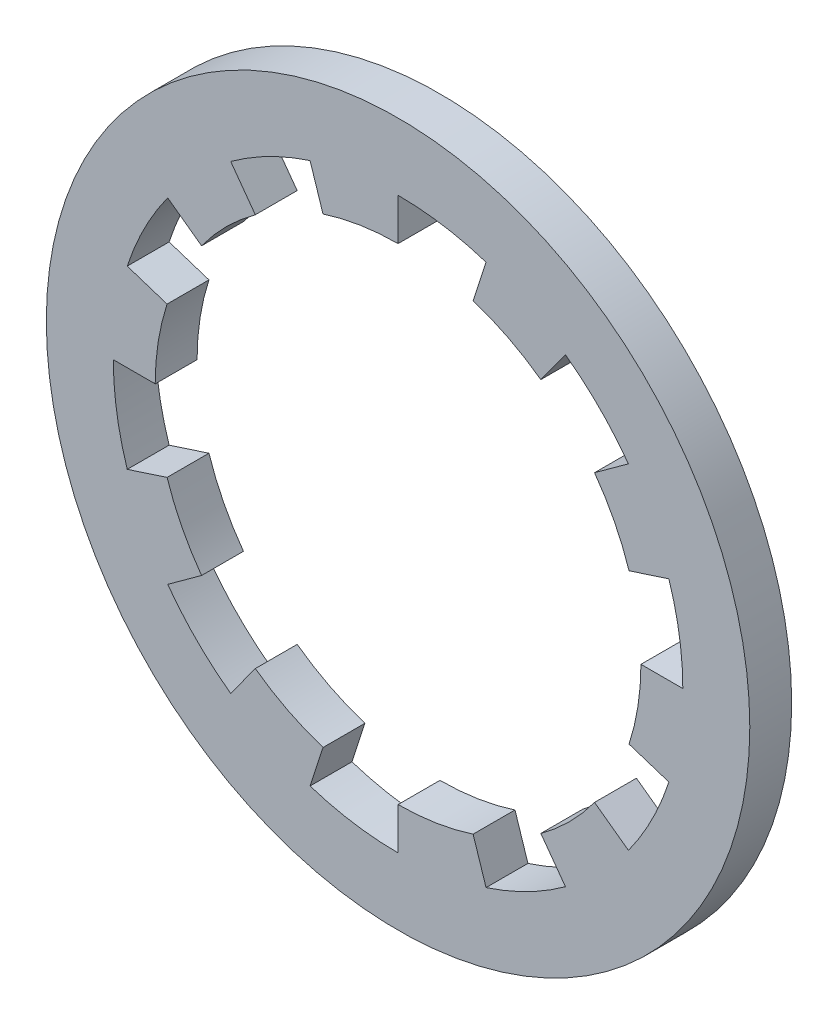
from build123d import *

# Parameters (mm, degrees)
SKETCH1_R           = 21
SKETCH1_R_2         = 14.5
BOSS_EXTRUDE1_DEPTH = 2.5
CUT_EXTRUDE1_START  = -4
CUT_EXTRUDE1_DEPTH  = 4


with BuildPart() as part:
    # Sketch1 → Boss-Extrude1 (new body)
    with BuildSketch(Plane.XY):
        Circle(SKETCH1_R)
        Circle(SKETCH1_R_2, mode=Mode.SUBTRACT)
    extrude(amount=BOSS_EXTRUDE1_DEPTH)

    # Sketch2 → Cut-Extrude1 (cut)
    with BuildSketch(Plane.XY.offset(2.5).offset(CUT_EXTRUDE1_START)):
        with BuildLine():
            Line((0, 17), (0, 14.5))
            ThreePointArc((0, 14.5), (2.268299743, 14.321480939), (4.480746418, 13.790319486))
            Line((4.480746418, 13.790319486), (5.253288904, 16.167960777))
            ThreePointArc((5.253288904, 16.167960777), (2.659385906, 16.79070179), (0, 17))
        make_face()
        with BuildLine():
            Line((9.992349289, 13.753288904), (8.522886158, 11.730746418))
            ThreePointArc((8.522886158, 11.730746418), (10.253048327, 10.253048327), (11.730746418, 8.522886158))
            Line((11.730746418, 8.522886158), (13.753288904, 9.992349289))
            ThreePointArc((13.753288904, 9.992349289), (12.02081528, 12.02081528), (9.992349289, 13.753288904))
        make_face()
        with BuildLine():
            Line((16.167960777, 5.253288904), (13.790319486, 4.480746418))
            ThreePointArc((13.790319486, 4.480746418), (14.321480939, 2.268299743), (14.5, 0))
            Line((14.5, 0), (17, 0))
            ThreePointArc((17, 0), (16.79070179, 2.659385906), (16.167960777, 5.253288904))
        make_face()
        with BuildLine():
            Line((16.167960777, -5.253288904), (13.790319486, -4.480746418))
            ThreePointArc((13.790319486, -4.480746418), (12.919594601, -6.582862246), (11.730746418, -8.522886158))
            Line((11.730746418, -8.522886158), (13.753288904, -9.992349289))
            ThreePointArc((13.753288904, -9.992349289), (15.147110911, -7.717838496), (16.167960777, -5.253288904))
        make_face()
        with BuildLine():
            Line((9.992349289, -13.753288904), (8.522886158, -11.730746418))
            ThreePointArc((8.522886158, -11.730746418), (6.582862246, -12.919594601), (4.480746418, -13.790319486))
            Line((4.480746418, -13.790319486), (5.253288904, -16.167960777))
            ThreePointArc((5.253288904, -16.167960777), (7.717838496, -15.147110911), (9.992349289, -13.753288904))
        make_face()
        with BuildLine():
            Line((0, -17), (0, -14.5))
            ThreePointArc((0, -14.5), (-2.268299743, -14.321480939), (-4.480746418, -13.790319486))
            Line((-4.480746418, -13.790319486), (-5.253288904, -16.167960777))
            ThreePointArc((-5.253288904, -16.167960777), (-2.659385906, -16.79070179), (0, -17))
        make_face()
        with BuildLine():
            Line((-9.992349289, -13.753288904), (-8.522886158, -11.730746418))
            ThreePointArc((-8.522886158, -11.730746418), (-10.253048327, -10.253048327), (-11.730746418, -8.522886158))
            Line((-11.730746418, -8.522886158), (-13.753288904, -9.992349289))
            ThreePointArc((-13.753288904, -9.992349289), (-12.02081528, -12.02081528), (-9.992349289, -13.753288904))
        make_face()
        with BuildLine():
            Line((-16.167960777, -5.253288904), (-13.790319486, -4.480746418))
            ThreePointArc((-13.790319486, -4.480746418), (-14.321480939, -2.268299743), (-14.5, 0))
            Line((-14.5, 0), (-17, 0))
            ThreePointArc((-17, 0), (-16.79070179, -2.659385906), (-16.167960777, -5.253288904))
        make_face()
        with BuildLine():
            Line((-16.167960777, 5.253288904), (-13.790319486, 4.480746418))
            ThreePointArc((-13.790319486, 4.480746418), (-12.919594601, 6.582862246), (-11.730746418, 8.522886158))
            Line((-11.730746418, 8.522886158), (-13.753288904, 9.992349289))
            ThreePointArc((-13.753288904, 9.992349289), (-15.147110911, 7.717838496), (-16.167960777, 5.253288904))
        make_face()
        with BuildLine():
            Line((-9.992349289, 13.753288904), (-8.522886158, 11.730746418))
            ThreePointArc((-8.522886158, 11.730746418), (-6.582862246, 12.919594601), (-4.480746418, 13.790319486))
            Line((-4.480746418, 13.790319486), (-5.253288904, 16.167960777))
            ThreePointArc((-5.253288904, 16.167960777), (-7.717838496, 15.147110911), (-9.992349289, 13.753288904))
        make_face()
    extrude(amount=CUT_EXTRUDE1_DEPTH, mode=Mode.SUBTRACT)


solid = part.part
